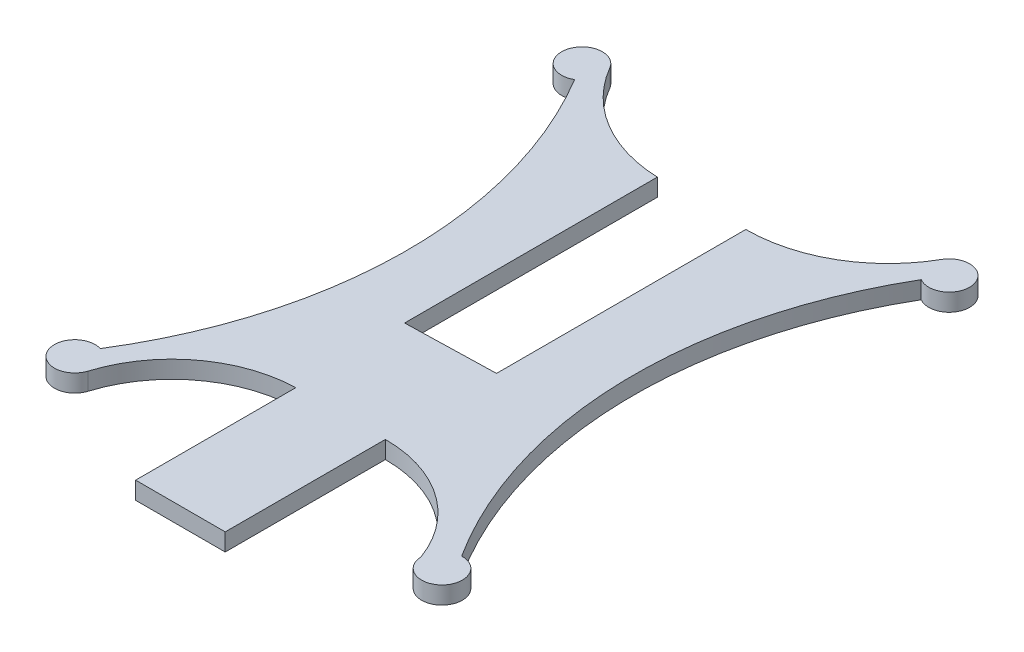
from build123d import *

# Parameters (mm, degrees)
BOSS_EXTRUDE2_DEPTH = 3


with BuildPart() as part:
    # Sketch1 → Boss-Extrude2 (new body)
    with BuildSketch(Plane(origin=(0, 0, 0), x_dir=(1, 0, 0), z_dir=(0, 1, 0))):
        with BuildLine():
            Line((25.757149381, -1.351865927), (25.757149381, 41.431167148))
            ThreePointArc((25.757149381, 41.431167148), (38.075697549, 44.757926971), (47.044816732, 53.833656195))
            ThreePointArc((47.044816732, 53.833656195), (53.444849138, 52.904300859), (48.262189364, 49.035948005))
            ThreePointArc((48.262189364, 49.035948005), (37.775812363, 8.529611884), (49.927233588, -31.508748857))
            ThreePointArc((49.927233588, -31.508748857), (52.6141246, -37.391327613), (46.554594416, -35.131635139))
            ThreePointArc((46.554594416, -35.131635139), (38.575085108, -24.669898603), (26.030357143, -20.701233785))
            Line((26.030357143, -20.701233785), (26.030357143, -48.189781488))
            Line((26.030357143, -48.189781488), (10.652357143, -48.189781488))
            Line((10.652357143, -48.189781488), (10.652357143, -20.701233785))
            ThreePointArc((10.652357143, -20.701233785), (-1.954368788, -25.111263089), (-9.626768487, -36.04342573))
            ThreePointArc((-9.626768487, -36.04342573), (-16.066621017, -36.637071695), (-11.932728711, -31.663637214))
            ThreePointArc((-11.932728711, -31.663637214), (-0.214526097, 8.575081304), (-11.212333327, 49.01663143))
            ThreePointArc((-11.212333327, 49.01663143), (-16.352559443, 52.941194032), (-9.942785871, 53.800797946))
            ThreePointArc((-9.942785871, 53.800797946), (-1.352444064, 45.093210402), (10.379149381, 41.631163543))
            Line((10.379149381, 41.631163543), (10.379149381, -1.751865927))
            Line((10.379149381, -1.751865927), (25.757149381, -1.351865927))
        make_face()
    extrude(amount=BOSS_EXTRUDE2_DEPTH)


solid = part.part
